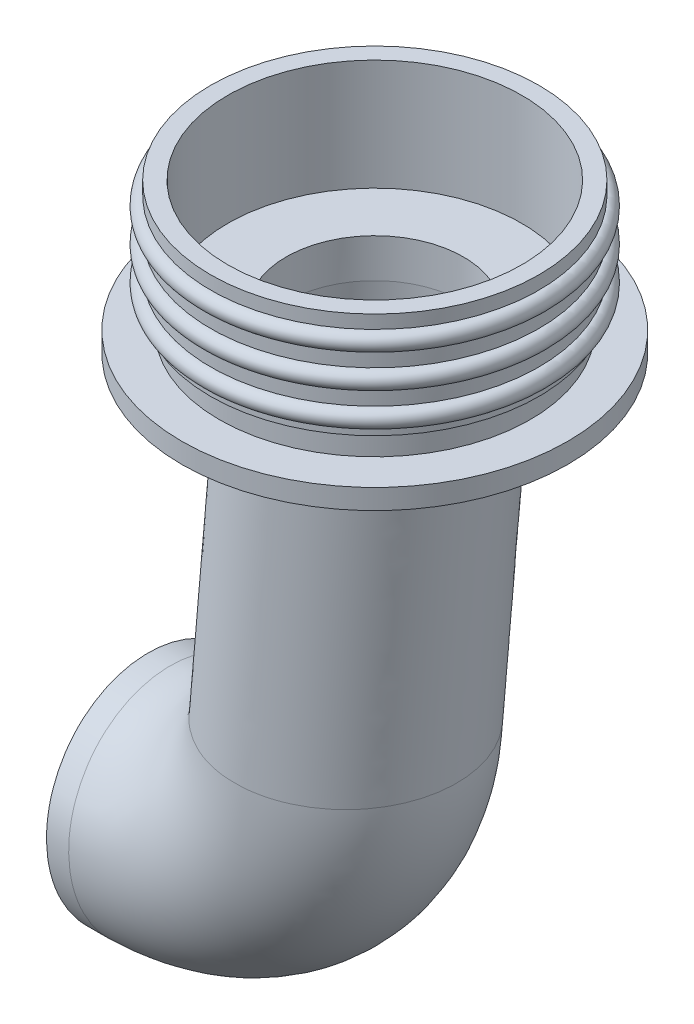
from build123d import *

# Parameters (mm, degrees)
SKETCH1_R           = 17.4
BOSS_EXTRUDE1_DEPTH = 1.81
SKETCH2_R           = 14.02
BOSS_EXTRUDE2_DEPTH = 2.2
SKETCH5_R           = 14.8
BOSS_EXTRUDE3_DEPTH = 9.5
SKETCH6_R           = 13.25
CUT_EXTRUDE1_DEPTH  = 10
SKETCH7_R           = 8
CUT_EXTRUDE2_DEPTH  = 27.561626456
SKETCH10_R          = 10
SKETCH10_R_2        = 8


with BuildPart() as part:
    # Sketch1 → Boss-Extrude1 (new body)
    with BuildSketch(Plane(origin=(0, 0, 0), x_dir=(1, 0, 0), z_dir=(0, 1, 0))):
        with Locations(Location((0, 0, 0), (0, 0, 270))):
            Circle(SKETCH1_R)
    extrude(amount=BOSS_EXTRUDE1_DEPTH)

    # Sketch2 → Boss-Extrude2 (add)
    with BuildSketch(Plane(origin=(0, 1.81, 0), x_dir=(1, 0, 0), z_dir=(0, 1, 0))):
        with Locations(Location((0, 0, 0), (0, 0, 270))):
            Circle(SKETCH2_R)
    extrude(amount=BOSS_EXTRUDE2_DEPTH)

    # Sketch5 → Boss-Extrude3 (add)
    with BuildSketch(Plane(origin=(0, 4.01, 0), x_dir=(1, 0, 0), z_dir=(0, 1, 0))):
        with Locations(Location((0, 0, 0), (0, 0, 270))):
            Circle(SKETCH5_R)
    extrude(amount=BOSS_EXTRUDE3_DEPTH)

    # Sketch6 → Cut-Extrude1 (cut)
    with BuildSketch(Plane(origin=(0, 13.51, 0), x_dir=(1, 0, 0), z_dir=(0, 1, 0))):
        with Locations(Location((0, 0, 0), (0, 0, 270))):
            Circle(SKETCH6_R)
    extrude(amount=-CUT_EXTRUDE1_DEPTH, mode=Mode.SUBTRACT)

    # Sketch7 → Cut-Extrude2 (cut, through all)
    with BuildSketch(Plane(origin=(0, 3.51, 0), x_dir=(1, 0, 0), z_dir=(0, 1, 0))):
        with Locations(Location((0, 0, 0), (0, 0, 270))):
            Circle(SKETCH7_R)
    extrude(amount=-CUT_EXTRUDE2_DEPTH, mode=Mode.SUBTRACT)

    # Sketch8 → Revolve1 (revolve)
    with BuildSketch(Plane(origin=(0, 0, 0), x_dir=(0, 0, -1), z_dir=(1, 0, 0)), mode=Mode.PRIVATE) as revolve1_sk:
        with BuildLine():
            Line((-14.8, 12.31), (-14.8, 10.71))
            ThreePointArc((-14.8, 10.71), (-15.6, 11.51), (-14.8, 12.31))
        make_face()
        with BuildLine():
            Line((-14.8, 7.71), (-14.8, 9.31))
            ThreePointArc((-14.8, 9.31), (-15.6, 8.51), (-14.8, 7.71))
        make_face()
        with BuildLine():
            Line((-14.8, 4.71), (-14.8, 6.31))
            ThreePointArc((-14.8, 6.31), (-15.6, 5.51), (-14.8, 4.71))
        make_face()
    revolve(revolve1_sk.sketch.rotate(Axis((0, 3.51, 0), (0, 1, 0)), 180), axis=Axis((0, 3.51, 0), (0, 1, 0)))

    # Sweep1: sweep along a path in Sketch9
    with BuildLine(Plane.XY) as sweep1_path:
        Line((0, 0), (-2.614672282, -29.885840943))
        ThreePointArc((-2.614672282, -29.885840943), (-7.42373964, -39.637664854), (-17.557592754, -43.578504802))
        Line((-17.557592754, -43.578504802), (-19.557592754, -43.578504802))
    # Sketch10 → Sweep1 (sweep)
    with BuildSketch(Plane.XZ):
        Circle(SKETCH10_R)
        Circle(SKETCH10_R_2, mode=Mode.SUBTRACT)
    sweep(path=sweep1_path.line)


solid = part.part
